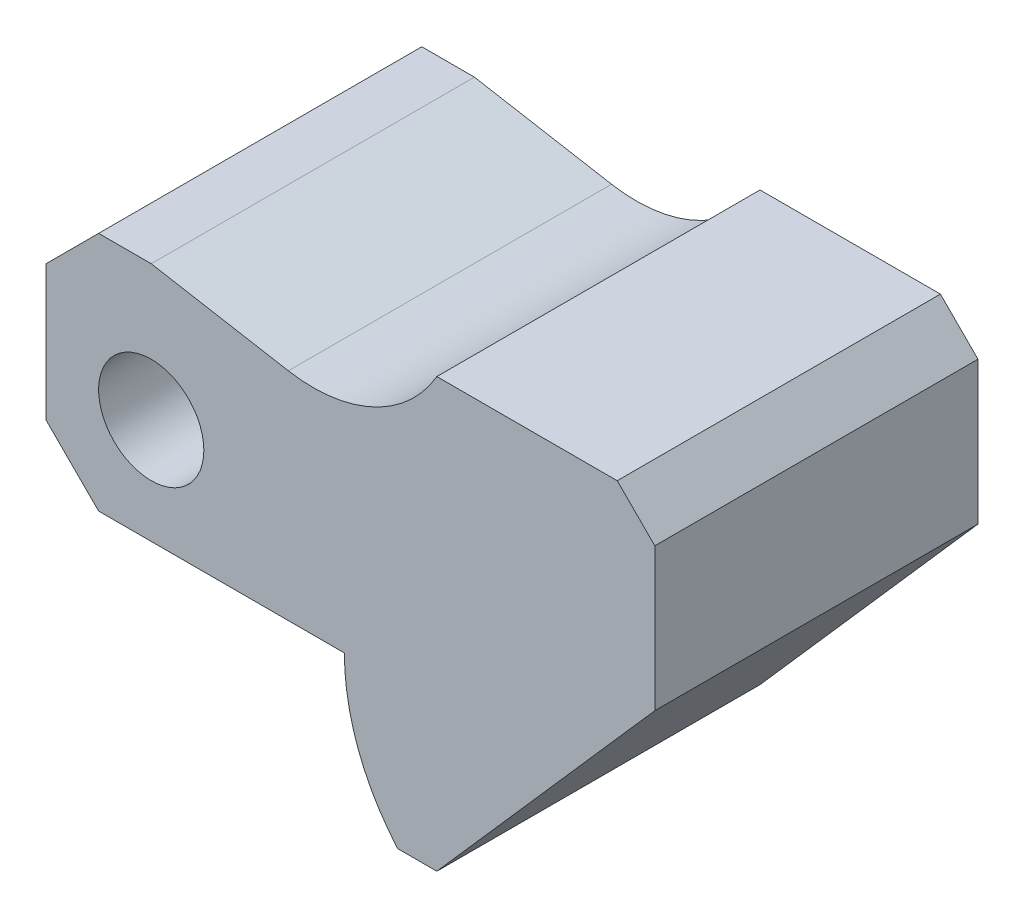
from build123d import *

# Parameters (mm, degrees)
SKETCH1_W              = 43
SKETCH1_H              = 32
BOSS_EXTRUDE1_DEPTH    = 29
SKETCH2_W              = 43
SKETCH2_H              = 38
SKETCH2_H_2            = 19
BOSS_EXTRUDE2_DEPTH    = 52
CHAMFER1_SIZE          = 7
SKETCH3_R              = 7
CUT_EXTRUDE1_DEPTH     = 78.440299586
CHAMFER2_SIZE          = 5
SPLIT1_SURFACE_1_BACK  = 108.977
SPLIT1_SURFACE_1_DEPTH = 217.954
CUT_EXTRUDE2_DEPTH     = 52
CUT_EXTRUDE7_DEPTH     = 78.440299586


with BuildPart() as part:
    # Sketch1 → Boss-Extrude1 (new body)
    with BuildSketch(Plane(origin=(0, 0, 0), x_dir=(0, 0, -1), z_dir=(1, 0, 0))):
        with Locations((-21.5, 16)):
            Rectangle(SKETCH1_W, SKETCH1_H)
    extrude(amount=-BOSS_EXTRUDE1_DEPTH)

    # Sketch2 → Boss-Extrude2 (add)
    with BuildSketch(Plane(origin=(0, 0, 0), x_dir=(0, 0, -1), z_dir=(1, 0, 0))):
        with Locations((-21.5, 19)):
            Rectangle(SKETCH2_W, SKETCH2_H)
        with Locations((-21.5, -9.5)):
            Rectangle(SKETCH2_W, SKETCH2_H_2)
    extrude(amount=BOSS_EXTRUDE2_DEPTH)

    # Chamfer1
    chamfer1_edges = [part.edges().sort_by_distance(p)[0] for p in [
        (-29, 0, 21.5),
        (-29, 32, 21.5),
    ]]
    chamfer(chamfer1_edges, length=CHAMFER1_SIZE)

    # Sketch3 → Cut-Extrude1 (cut, through all)
    with BuildSketch(Plane.XY.offset(43)):
        with Locations((-15, 14)):
            Circle(SKETCH3_R)
    extrude(amount=-CUT_EXTRUDE1_DEPTH, mode=Mode.SUBTRACT)

    # Chamfer2
    chamfer2_edges = [part.edges().sort_by_distance(p)[0] for p in [
        (52, 38, 21.5),
    ]]
    chamfer(chamfer2_edges, length=CHAMFER2_SIZE)

    # Split1: cut with a surface, the side behind it stays
    # Split1 surface: a surface, the sketch's curves swept straight by 217.954 mm
    with BuildLine(Plane.XY.offset(-SPLIT1_SURFACE_1_BACK), mode=Mode.PRIVATE) as split1_surface_1_path:
        Line((-15, 32), (3.243084988, 28.783251905))
        ThreePointArc((3.243084988, 28.783251905), (14.574972961, 30.276069151), (23, 38))
    split1_surface_1 = Shell.extrude(split1_surface_1_path.wire(), (0 * SPLIT1_SURFACE_1_DEPTH, 0 * SPLIT1_SURFACE_1_DEPTH, 1 * SPLIT1_SURFACE_1_DEPTH))
    split(bisect_by=split1_surface_1, keep=Keep.BOTTOM)

    # Sketch6 → Cut-Extrude2 (cut)
    with BuildSketch(Plane.XY.offset(43)):
        Polygon((52, -19), (52, 14), (23, -19), align=None)
    extrude(amount=-CUT_EXTRUDE2_DEPTH, mode=Mode.SUBTRACT)

    # Sketch7 → Cut-Extrude7 (cut, through all)
    with BuildSketch(Plane.XY.offset(43)):
        with BuildLine():
            ThreePointArc((17.788067397, -19), (12.527518408, -10.140064923), (10.696969697, 0))
            Line((10.696969697, 0), (0, 0))
            Line((0, 0), (0, -19))
            Line((0, -19), (17.788067397, -19))
        make_face()
    extrude(amount=-CUT_EXTRUDE7_DEPTH, mode=Mode.SUBTRACT)


solid = part.part
